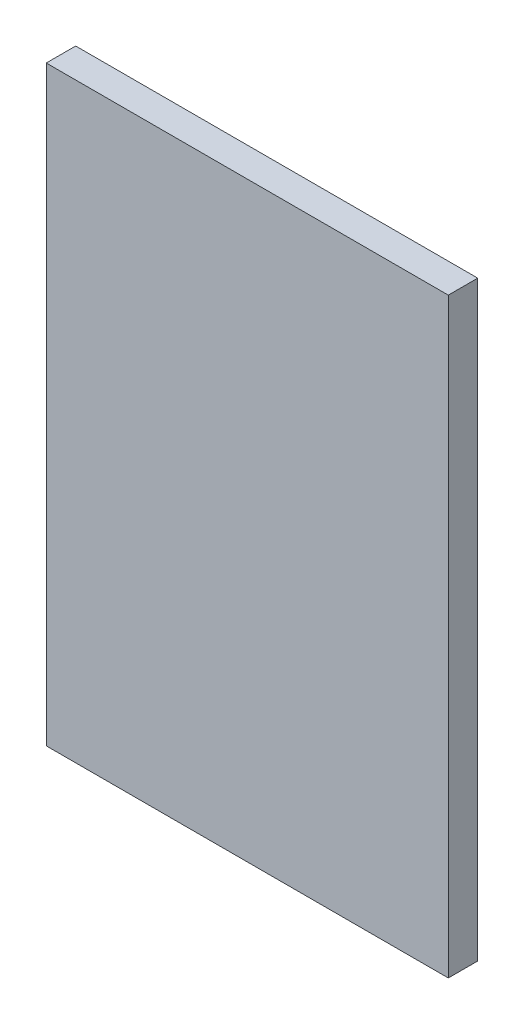
from build123d import *

# Parameters (mm, degrees)
SKETCH1_W      = 69.386216698
SKETCH1_H      = 102.061166388
EXTRUDE1_DEPTH = 5.08


with BuildPart() as part:
    # Sketch1 → Extrude1 (new body)
    with BuildSketch(Plane.XY):
        Rectangle(SKETCH1_W, SKETCH1_H)
    extrude(amount=EXTRUDE1_DEPTH)


solid = part.part
